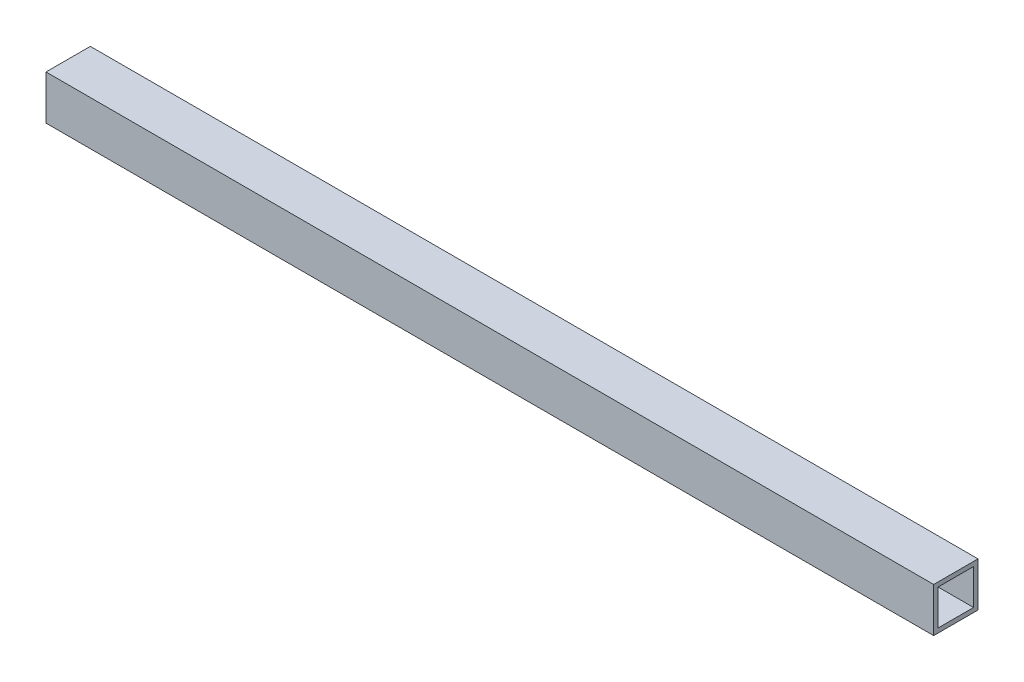
from build123d import *

# Parameters (mm, degrees)
SKETCH1_W             = 20
SKETCH1_H             = 20
SKETCH1_W_2           = 16
SKETCH1_H_2           = 16
F_20_X_20_X_2_1_DEPTH = 400.5


with BuildPart() as part:
    # Sketch1 → 方形管 20 X 20 X 2 无圆角(1) (new body)
    with BuildSketch(Plane.YZ):
        Rectangle(SKETCH1_W, SKETCH1_H)
        Rectangle(SKETCH1_W_2, SKETCH1_H_2, mode=Mode.SUBTRACT)
    extrude(amount=F_20_X_20_X_2_1_DEPTH)


solid = part.part
